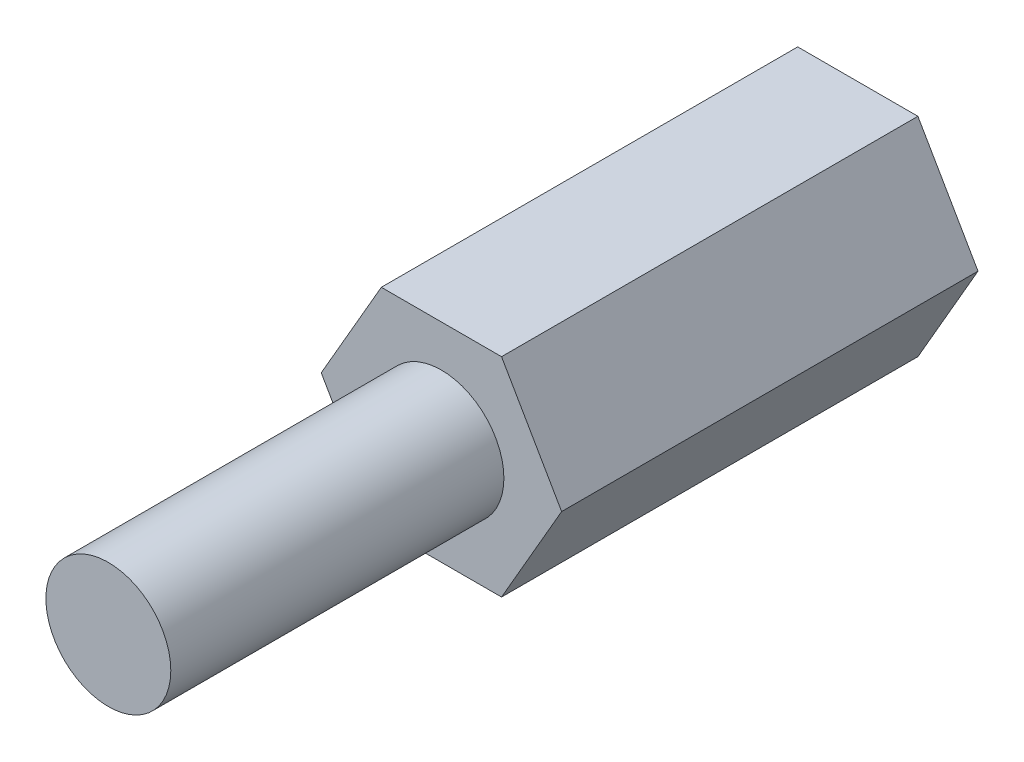
from build123d import *

# Parameters (mm, degrees)
BOSS_EXTRU_1_DEPTH      = 10
ESQUISSE2_R             = 1.5
BOSS_EXTRU_2_DEPTH      = 8
ESQUISSE3_R             = 1.5
ENL_V_MAT_EXTRU_1_DEPTH = 8


with BuildPart() as part:
    # Esquisse1 → Boss.-Extru.1 (new body)
    with BuildSketch(Plane.XY):
        Polygon((2.886751346, 0), (1.443375673, 2.5), (-1.443375673, 2.5), (-2.886751346, 0), (-1.443375673, -2.5), (1.443375673, -2.5), align=None)
    extrude(amount=BOSS_EXTRU_1_DEPTH)

    # Esquisse2 → Boss.-Extru.2 (add)
    with BuildSketch(Plane.XY.offset(10)):
        Circle(ESQUISSE2_R)
    extrude(amount=BOSS_EXTRU_2_DEPTH)

    # Esquisse3 → Enlèv. mat.-Extru.1 (cut)
    with BuildSketch(Plane(origin=(0, 0, 0), x_dir=(-1, 0, 0), z_dir=(0, 0, -1))):
        with Locations(Location((0, 0, 0), (0, 0, 180))):
            Circle(ESQUISSE3_R)
    extrude(amount=-ENL_V_MAT_EXTRU_1_DEPTH, mode=Mode.SUBTRACT)


solid = part.part
